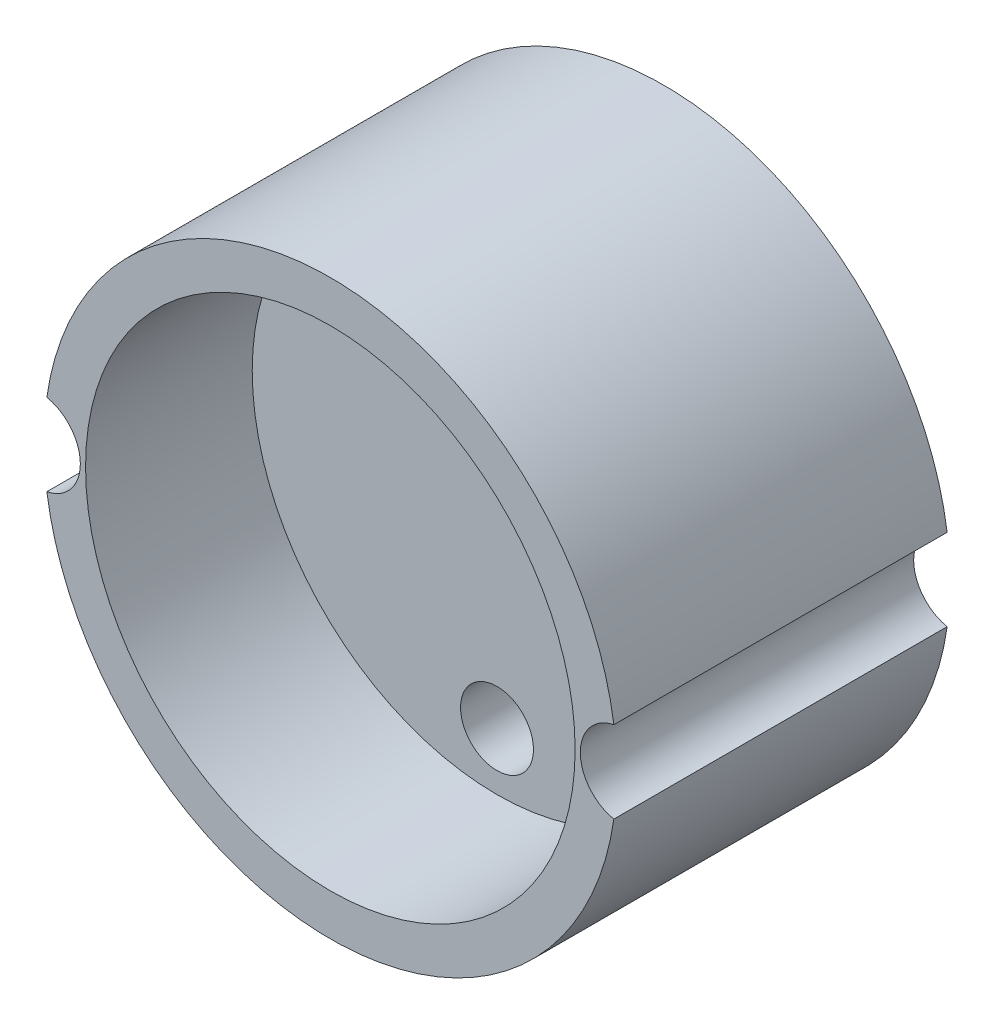
from build123d import *

# Parameters (mm, degrees)
SKETCH1_R           = 13.75
BOSS_EXTRUDE1_DEPTH = 16
SKETCH2_R           = 11.75
CUT_EXTRUDE1_DEPTH  = 8
SKETCH3_R           = 1.75
CUT_EXTRUDE2_DEPTH  = 26.181838694
SKETCH4_R           = 2
CUT_EXTRUDE4_DEPTH  = 26.181838694


with BuildPart() as part:
    # Sketch1 → Boss-Extrude1 (new body)
    with BuildSketch(Plane(origin=(0, 0, 0), x_dir=(0, 1, 0), z_dir=(0, 0, 1))):
        with Locations(Location((0, 0, 0), (0, 0, 270))):
            Circle(SKETCH1_R)
    extrude(amount=BOSS_EXTRUDE1_DEPTH)

    # Sketch2 → Cut-Extrude1 (cut)
    with BuildSketch(Plane(origin=(0, 0, 16), x_dir=(0, -1, 0), z_dir=(0, 0, 1))):
        with Locations(Location((0, 0, 0), (0, 0, 90))):
            Circle(SKETCH2_R)
    extrude(amount=-CUT_EXTRUDE1_DEPTH, mode=Mode.SUBTRACT)

    # Sketch3 → Cut-Extrude2 (cut, through all)
    with BuildSketch(Plane(origin=(0, 0, 0), x_dir=(1, 0, 0), z_dir=(0, 0, -1))):
        with Locations(Location((0, 9, 0), (0, 0, 180))):
            Circle(SKETCH3_R)
        with Locations(Location((0, -9, 0), (0, 0, 180))):
            Circle(SKETCH3_R)
    extrude(amount=-CUT_EXTRUDE2_DEPTH, mode=Mode.SUBTRACT)

    # Sketch4 → Cut-Extrude4 (cut, through all)
    with BuildSketch(Plane(origin=(0, 0, 0), x_dir=(1, 0, 0), z_dir=(0, 0, -1))):
        with Locations((-14, 0)):
            Circle(SKETCH4_R)
    cut_extrude4 = extrude(amount=-CUT_EXTRUDE4_DEPTH, mode=Mode.SUBTRACT)

    # Mirror1: Cut-Extrude4 across plane
    add(cut_extrude4.mirror(Plane(origin=(0, 0, 0), x_dir=(0, 0, 1), z_dir=(1, 0, 0))), mode=Mode.SUBTRACT)


solid = part.part
